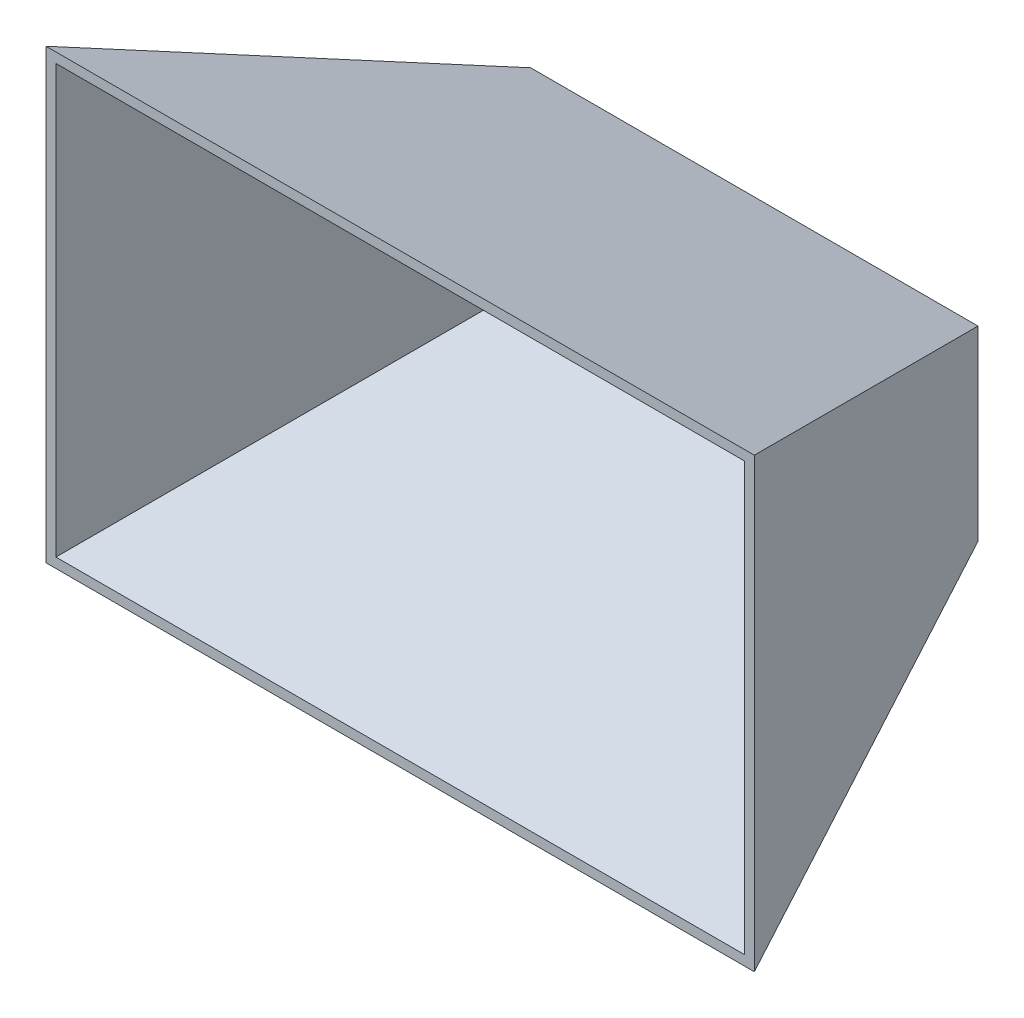
from build123d import *

# Parameters (mm, degrees)
SHELL1_T            = -10
CUT_EXTRUDE14_DEPTH = 948.525735605


with BuildPart() as part:
    # Sketch17 → Loft1 section 0
    with BuildSketch(Plane.XY):
        with BuildLine():
            Line((-87.319408537, -550.76508799), (392.680591463, -550.76508799))
            Line((392.680591463, -550.76508799), (392.680591463, -350.76508799))
            Line((392.680591463, -350.76508799), (-87.319408537, -350.76508799))
            Line((-87.319408537, -350.76508799), (-87.319408537, -550.76508799))
        make_face()
    # Sketch18 → Loft1 section 1
    with BuildSketch(Plane.XY.offset(380)):
        with BuildLine():
            Line((-227.319408537, -690.76508799), (532.680591463, -690.76508799))
            Line((532.680591463, -690.76508799), (532.680591463, -210.76508799))
            Line((532.680591463, -210.76508799), (-227.319408537, -210.76508799))
            Line((-227.319408537, -210.76508799), (-227.319408537, -690.76508799))
        make_face()
    loft()

    # Shell1
    shell1_openings = [part.faces().sort_by_distance(p)[0] for p in [
        (152.680591463, -450.76508799, 380),
    ]]
    offset(amount=SHELL1_T, openings=shell1_openings, kind=Kind.INTERSECTION)

    # Sketch19 → Cut-Extrude14 (cut, through all)
    with BuildSketch(Plane.XY.offset(10)):
        Polygon((-80.346536573, -357.737959954), (105.707719499, -357.737959954), (385.707719499, -357.737959954), (385.707719499, -543.792216026), (-80.346536573, -543.792216026), align=None)
    extrude(amount=-CUT_EXTRUDE14_DEPTH, mode=Mode.SUBTRACT)


solid = part.part
